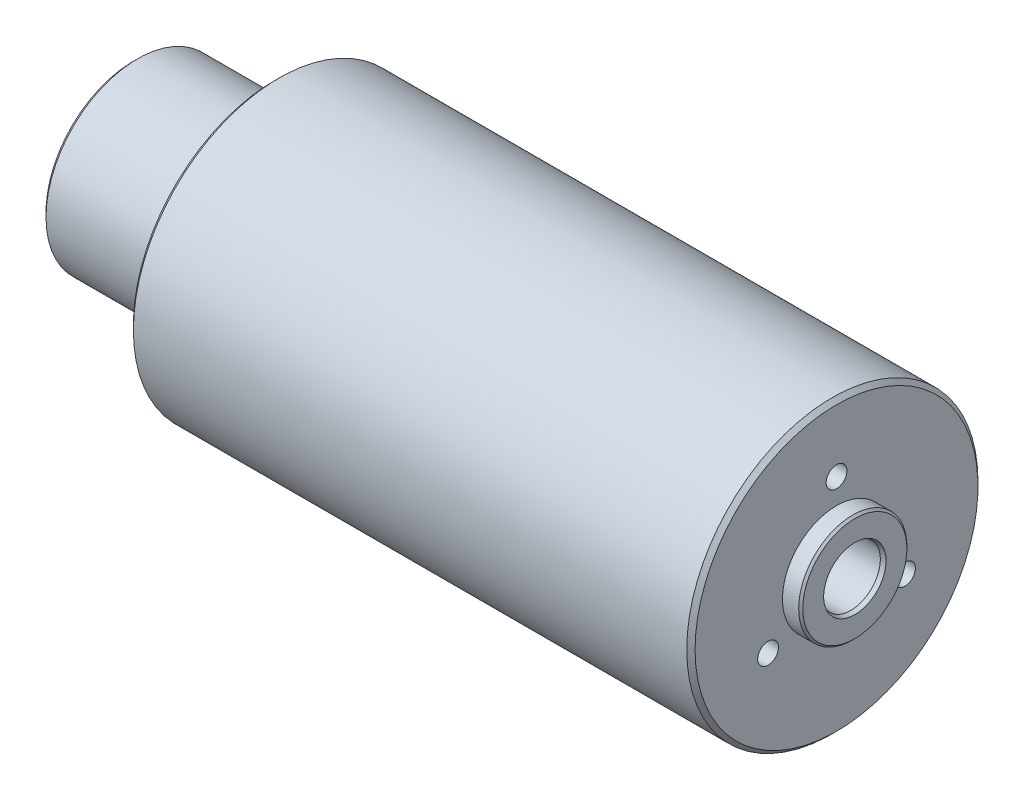
from build123d import *

# Parameters (mm, degrees)
CHANFREIN2_SIZE                   = 0.25
R_P_TITION_CIRCULAIRE1_COUNT      = 3
CHANFREIN3_SIZE                   = 0.5
D_GAGEMENT_POUR_M6_51_D           = 7.1
D_GAGEMENT_POUR_M6_51_DEPTH       = 20
D_GAGEMENT_POUR_M6_51_CSINK_D     = 7.5
D_GAGEMENT_POUR_M6_51_CSINK_ANGLE = 45
D_GAGEMENT_POUR_M6_51_TIP         = 2.133055198


with BuildPart() as part:
    # Esquisse1 → Base-Révolution (revolve)
    with BuildSketch(Plane.XY):
        Polygon((2.2, 0), (2.2, 6.5), (0, 6.5), (0, 17.5), (-67.500713504, 17.5), (-67.500713504, 11), (-84.500713504, 11), (-84.500713504, 0), align=None)
    revolve(axis=Axis((-71.12515213, 0, 0), (1, 0, 0)))

    # Chanfrein2
    chanfrein2_edges = [part.edges().sort_by_distance(p)[0] for p in [
        (2.2, -6.5, 0),
    ]]
    chamfer(chanfrein2_edges, length=CHANFREIN2_SIZE)

    # Esquisse2 → Trou taraudé M2.5x0.451 (revolve, cut)
    with BuildSketch(Plane(origin=(0, 9.5, 0), x_dir=(0, 0, -1), z_dir=(0, 1, 0))):
        Polygon((0, 0), (0, 7.365882135), (1.025, 6.75), (1.025, 4.5), (1.25, 4.5), (1.25, 0), align=None)
    trou_taraud_m2_5x0_451 = revolve(axis=Axis((6.35, 9.5, 0), (-1, 0, 0)), mode=Mode.SUBTRACT)

    # Répétition circulaire1: Trou taraudé M2.5x0.451 ×3 about axis
    r_p_tition_circulaire1_axis = Axis((-21.12515213, 0, 0), (-1, 0, 0))
    for i in range(1, R_P_TITION_CIRCULAIRE1_COUNT):
        add(trou_taraud_m2_5x0_451.rotate(r_p_tition_circulaire1_axis, i * 360 / R_P_TITION_CIRCULAIRE1_COUNT), mode=Mode.SUBTRACT)

    # Chanfrein3
    chanfrein3_edges = [part.edges().sort_by_distance(p)[0] for p in [
        (-84.500713504, -11, 0),
        (-67.500713504, -17.5, 0),
        (0, -17.5, 0),
    ]]
    chamfer(chanfrein3_edges, length=CHANFREIN3_SIZE)

    # Dégagement pour M6.51
    with Locations(Plane(origin=(2.2, 0, 0), x_dir=(0, 0, -1), z_dir=(1, 0, 0))):
        with Locations((0, 0)):
            CounterSinkHole(D_GAGEMENT_POUR_M6_51_D / 2, D_GAGEMENT_POUR_M6_51_CSINK_D / 2, depth=D_GAGEMENT_POUR_M6_51_DEPTH, counter_sink_angle=D_GAGEMENT_POUR_M6_51_CSINK_ANGLE)
            with Locations((0, 0, -(D_GAGEMENT_POUR_M6_51_DEPTH + D_GAGEMENT_POUR_M6_51_TIP / 2))):  # 118° drill point
                Cone(0, D_GAGEMENT_POUR_M6_51_D / 2, D_GAGEMENT_POUR_M6_51_TIP, mode=Mode.SUBTRACT)


solid = part.part
